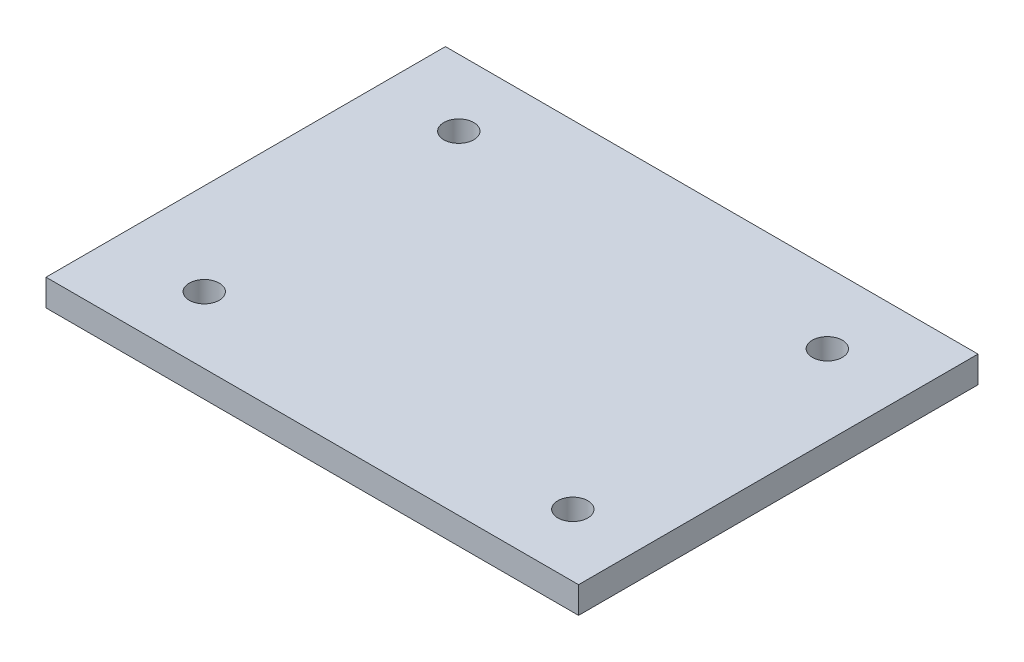
from build123d import *

# Parameters (mm, degrees)
SKETCH1_W           = 80
SKETCH1_H           = 60
BOSS_EXTRUDE1_DEPTH = 4
SKETCH2_R           = 2.25
CUT_EXTRUDE1_DEPTH  = 101.079968026


with BuildPart() as part:
    # Sketch1 → Boss-Extrude1 (new body)
    with BuildSketch(Plane(origin=(0, 0, 0), x_dir=(1, 0, 0), z_dir=(0, 1, 0))):
        with Locations((40, -30)):
            Rectangle(SKETCH1_W, SKETCH1_H)
    extrude(amount=BOSS_EXTRUDE1_DEPTH)

    # Sketch2 → Cut-Extrude1 (cut, through all)
    with BuildSketch(Plane(origin=(0, 4, 0), x_dir=(1, 0, 0), z_dir=(0, 1, 0))):
        with Locations(Location((12.003571958, -10, 0), (0, 0, 270))):
            Circle(SKETCH2_R)
        with Locations(Location((68, -10.632492363, 0), (0, 0, 270))):
            Circle(SKETCH2_R)
        with Locations(Location((69.767270972, -50.632492363, 0), (0, 0, 270))):
            Circle(SKETCH2_R)
        with Locations(Location((13.770842931, -50, 0), (0, 0, 270))):
            Circle(SKETCH2_R)
    extrude(amount=-CUT_EXTRUDE1_DEPTH, mode=Mode.SUBTRACT)


solid = part.part
